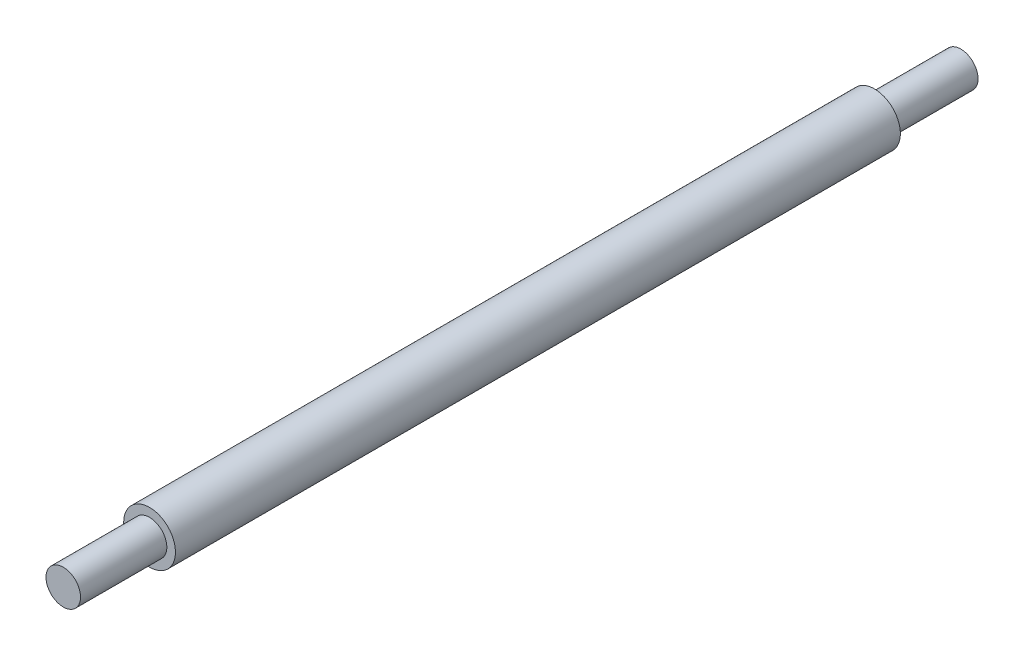
from build123d import *


with BuildPart() as part:
    # Sketch1 → Revolve1 (revolve)
    with BuildSketch(Plane(origin=(0, 0, 0), x_dir=(0, 0, -1), z_dir=(1, 0, 0)), mode=Mode.PRIVATE) as revolve1_sk:
        Polygon((0, 0), (0, 2), (10, 2), (10, 3), (94, 3), (94, 2), (104, 2), (104, 0), align=None)
    revolve(revolve1_sk.sketch.rotate(Axis((0, 0, -104), (0, 0, 1)), 90), axis=Axis((0, 0, -104), (0, 0, 1)))


solid = part.part
